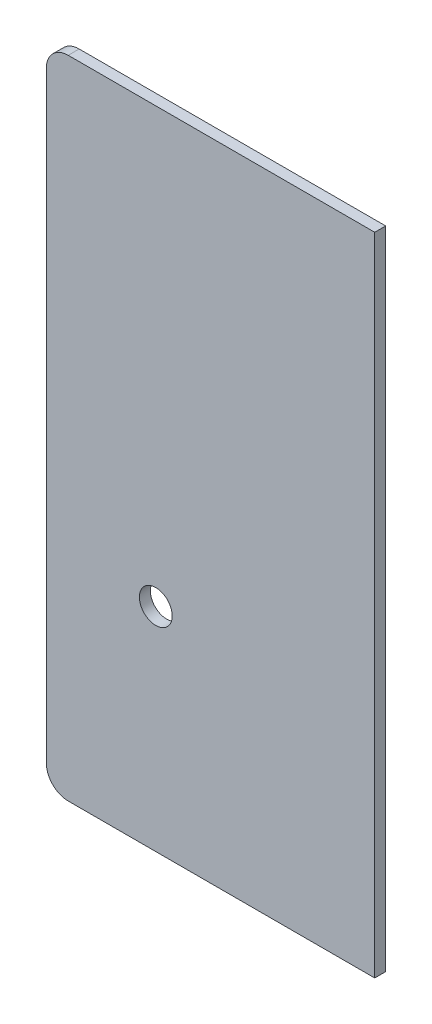
from build123d import *

# Parameters (mm, degrees)
SKETCH1_R           = 1.5
BOSS_EXTRUDE1_DEPTH = 1


with BuildPart() as part:
    # Sketch1 → Boss-Extrude1 (new body)
    with BuildSketch(Plane.XY):
        with BuildLine():
            Line((-44, 49.75), (-44, -9.25))
            Line((-44, -9.25), (-72, -9.25))
            ThreePointArc((-72, -9.25), (-73.414213562, -8.664213562), (-74, -7.25))
            Line((-74, -7.25), (-74, 47.75))
            ThreePointArc((-74, 47.75), (-73.414213562, 49.164213562), (-72, 49.75))
            Line((-72, 49.75), (-44, 49.75))
        make_face()
        with Locations((-64, 10.14)):
            Circle(SKETCH1_R, mode=Mode.SUBTRACT)
    extrude(amount=BOSS_EXTRUDE1_DEPTH)


solid = part.part
